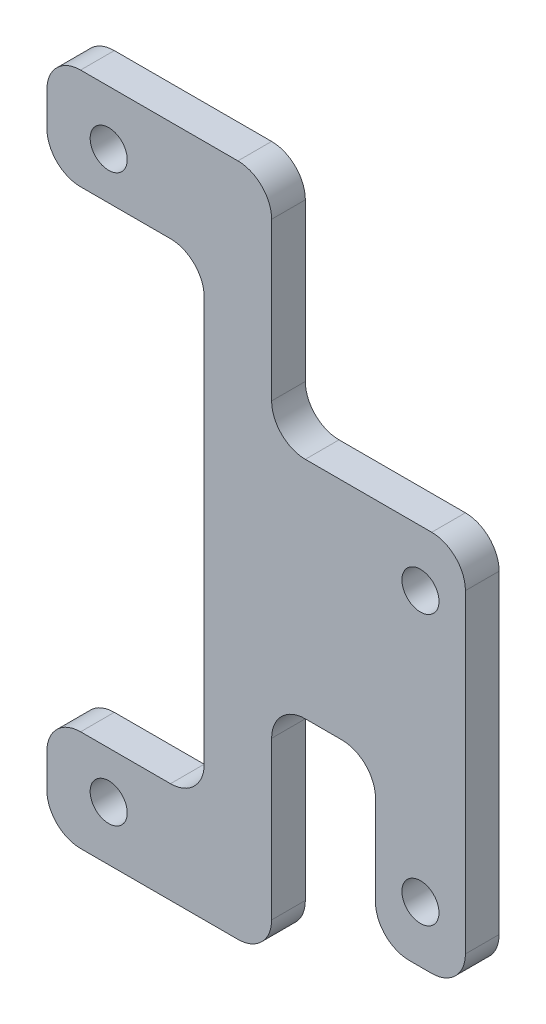
from build123d import *

# Parameters (mm, degrees)
SKETCH1_W           = 8
SKETCH1_H           = 34
SKETCH1_R           = 1.65
BOSS_EXTRUDE1_DEPTH = 3
SKETCH9_W           = 3
SKETCH9_H           = 20
BOSS_EXTRUDE6_DEPTH = 9.245
SKETCH10_W          = 3
SKETCH10_H          = 60
BOSS_EXTRUDE7_DEPTH = 20
SKETCH11_W          = 14
SKETCH11_H          = 42
CUT_EXTRUDE1_DEPTH  = 10
SKETCH12_R          = 1.65
CUT_EXTRUDE2_DEPTH  = 10
FILLET7_R           = 3


with BuildPart() as part:
    # Sketch1 → Boss-Extrude1 (new body)
    with BuildSketch(Plane.XY):
        Rectangle(SKETCH1_W, SKETCH1_H)
        with Locations((0, 12)):
            Circle(SKETCH1_R, mode=Mode.SUBTRACT)
        with Locations(Location((0, -12, 0), (0, 0, 180))):
            Circle(SKETCH1_R, mode=Mode.SUBTRACT)
    extrude(amount=BOSS_EXTRUDE1_DEPTH)

    # Sketch9 → Boss-Extrude6 (add)
    with BuildSketch(Plane.ZY.offset(4)):
        with Locations((1.5, 7)):
            Rectangle(SKETCH9_W, SKETCH9_H)
    extrude(amount=BOSS_EXTRUDE6_DEPTH)

    # Sketch10 → Boss-Extrude7 (add)
    with BuildSketch(Plane.ZY.offset(13.245)):
        with Locations((1.5, 7)):
            Rectangle(SKETCH10_W, SKETCH10_H)
    extrude(amount=BOSS_EXTRUDE7_DEPTH)

    # Sketch11 → Cut-Extrude1 (cut)
    with BuildSketch(Plane.XY.offset(3)):
        with Locations((-26.245, 7)):
            Rectangle(SKETCH11_W, SKETCH11_H)
    extrude(amount=-CUT_EXTRUDE1_DEPTH, mode=Mode.SUBTRACT)

    # Sketch12 → Cut-Extrude2 (cut)
    with BuildSketch(Plane.XY.offset(3)):
        with Locations((-27.745, 32.17)):
            Circle(SKETCH12_R)
        with Locations((-27.745, -18.17)):
            Circle(SKETCH12_R)
    extrude(amount=-CUT_EXTRUDE2_DEPTH, mode=Mode.SUBTRACT)

    # Fillet7
    fillet7_edges = [part.edges().sort_by_distance(p)[0] for p in [
        (-4, -3, 1.5),
        (-13.245, -3, 1.5),
        (-13.245, 17, 1.5),
        (-13.245, 37, 1.5),
        (-13.245, -23, 1.5),
        (-33.245, 37, 1.5),
        (-33.245, -23, 1.5),
        (-33.245, -14, 1.5),
        (-33.245, 28, 1.5),
        (-19.245, 28, 1.5),
        (-19.245, -14, 1.5),
        (4, -17, 1.5),
        (-4, -17, 1.5),
        (4, 17, 1.5),
    ]]
    fillet(fillet7_edges, radius=FILLET7_R)


solid = part.part
